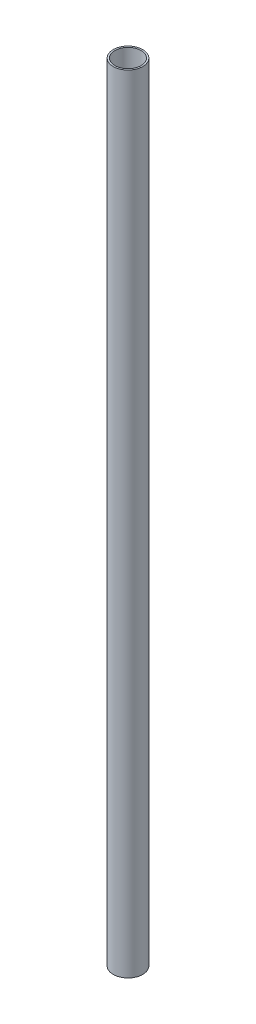
from build123d import *

# Parameters (mm, degrees)
SKETCH1_R           = 22.5
BOSS_EXTRUDE1_DEPTH = 1200
SKETCH2_R           = 20
CUT_EXTRUDE1_DEPTH  = 1201.421800868


with BuildPart() as part:
    # Sketch1 → Boss-Extrude1 (new body)
    with BuildSketch(Plane(origin=(0, 0, 0), x_dir=(1, 0, 0), z_dir=(0, 1, 0))):
        with Locations(Location((0, 0, 0), (0, 0, 270))):
            Circle(SKETCH1_R)
    extrude(amount=BOSS_EXTRUDE1_DEPTH)

    # Sketch2 → Cut-Extrude1 (cut, through all)
    with BuildSketch(Plane(origin=(0, 1200, 0), x_dir=(1, 0, 0), z_dir=(0, 1, 0))):
        with Locations(Location((0, 0, 0), (0, 0, 270))):
            Circle(SKETCH2_R)
    extrude(amount=-CUT_EXTRUDE1_DEPTH, mode=Mode.SUBTRACT)


solid = part.part
